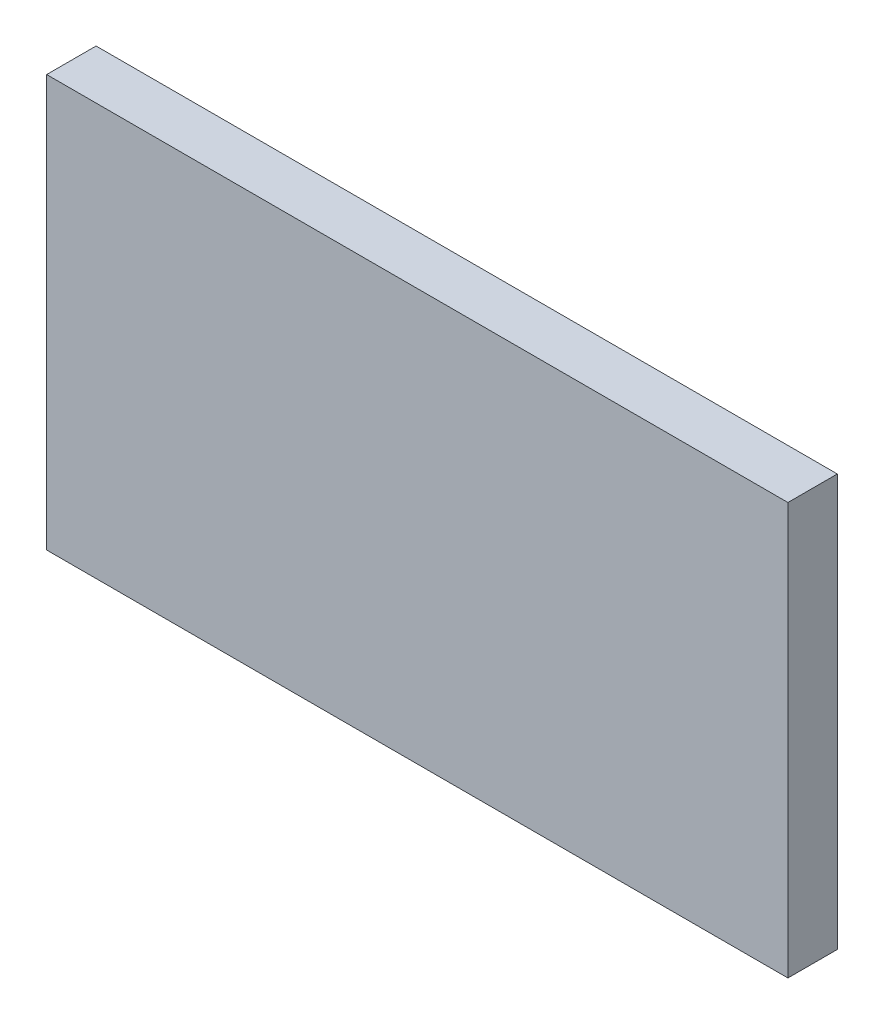
from build123d import *

# Parameters (mm, degrees)
SKETCH1_W           = 45
SKETCH1_H           = 25
BOSS_EXTRUDE1_DEPTH = 3


with BuildPart() as part:
    # Sketch1 → Boss-Extrude1 (new body)
    with BuildSketch(Plane.XY):
        with Locations((1.473634512, 0.429308701)):
            Rectangle(SKETCH1_W, SKETCH1_H)
    extrude(amount=BOSS_EXTRUDE1_DEPTH)


solid = part.part
